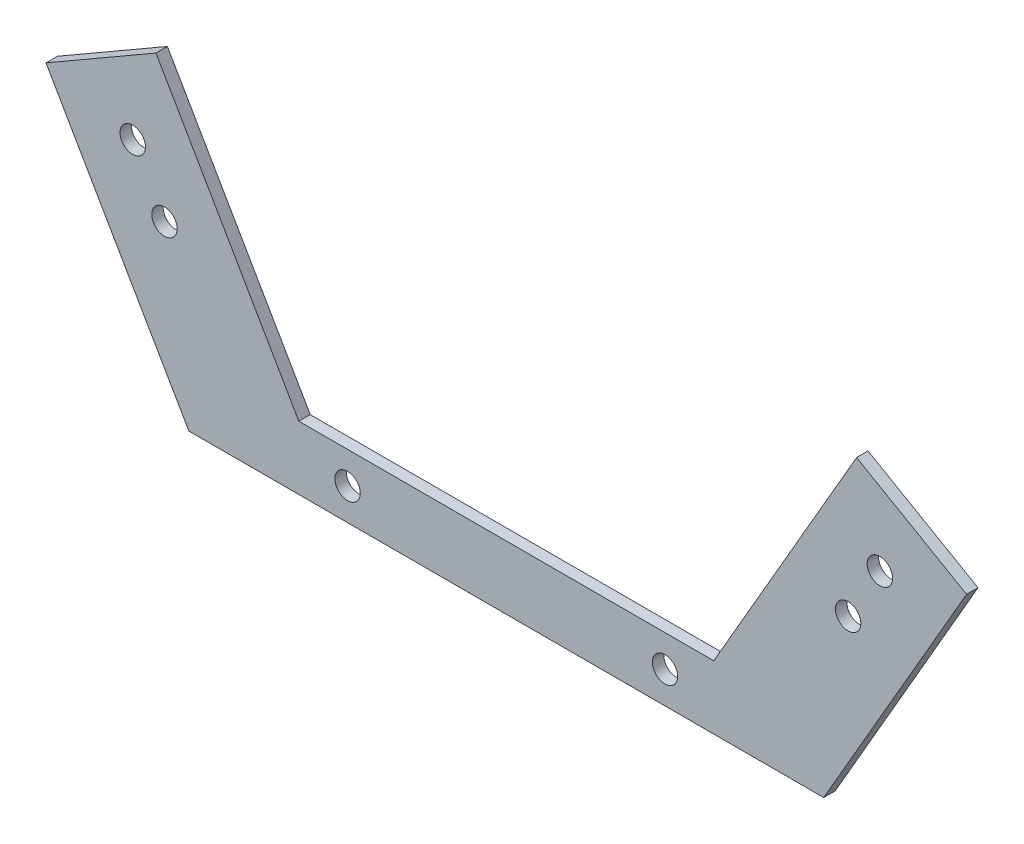
from build123d import *

# Parameters (mm, degrees)
EXTRUDE_2_DEPTH     = 1.8
SKETCH_2_R          = 2
CUT_EXTRUDE_3_DEPTH = 1.8


with BuildPart() as part:
    # 草圖1 → 填料-伸長2 (new body)
    with BuildSketch(Plane.XY):
        Polygon((-40.127945462, -52.376209375), (59.872054538, -52.376209375), (82.372054538, -13.405066204), (65.051546462, -3.405066204), (42.551546462, -42.376209375), (-22.807437387, -42.376209375), (-45.307437387, -3.405066204), (-62.627945462, -13.405066204), align=None)
    extrude(amount=EXTRUDE_2_DEPTH)

    # 草圖2 → 除料-伸長3 (cut)
    with BuildSketch(Plane.XY.offset(1.8)):
        with Locations((-48.967691424, -17.065320242)):
            Circle(SKETCH_2_R)
        with Locations((68.7118005, -17.065320242)):
            Circle(SKETCH_2_R)
        with Locations((-43.967691424, -25.72557428)):
            Circle(SKETCH_2_R)
        with Locations((63.7118005, -25.72557428)):
            Circle(SKETCH_2_R)
        with Locations((-15.127945462, -47.376209375)):
            Circle(SKETCH_2_R)
        with Locations((34.872054538, -47.376209375)):
            Circle(SKETCH_2_R)
    extrude(amount=-CUT_EXTRUDE_3_DEPTH, mode=Mode.SUBTRACT)


solid = part.part
